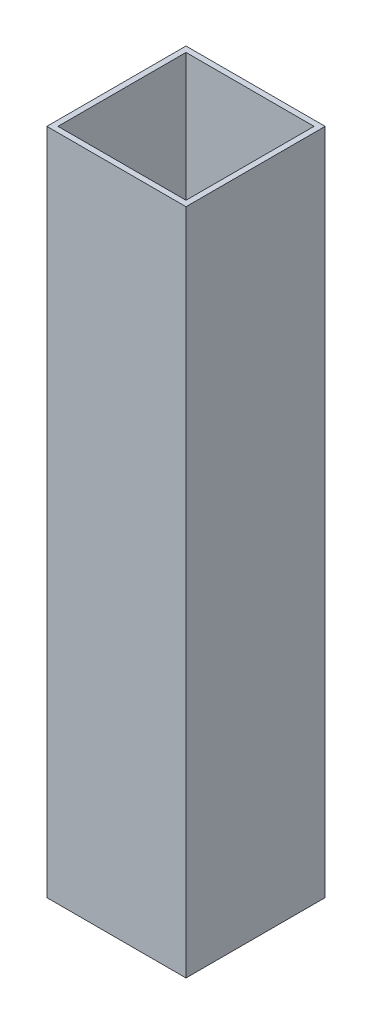
from build123d import *

# Parameters (mm, degrees)
SKETCH1_W           = 50
SKETCH1_H           = 50
SKETCH1_W_2         = 46
SKETCH1_H_2         = 46
BOSS_EXTRUDE1_DEPTH = 240


with BuildPart() as part:
    # Sketch1 → Boss-Extrude1 (new body)
    with BuildSketch(Plane(origin=(0, 0, 0), x_dir=(1, 0, 0), z_dir=(0, 1, 0))):
        Rectangle(SKETCH1_W, SKETCH1_H)
        Rectangle(SKETCH1_W_2, SKETCH1_H_2, mode=Mode.SUBTRACT)
    extrude(amount=BOSS_EXTRUDE1_DEPTH)


solid = part.part
